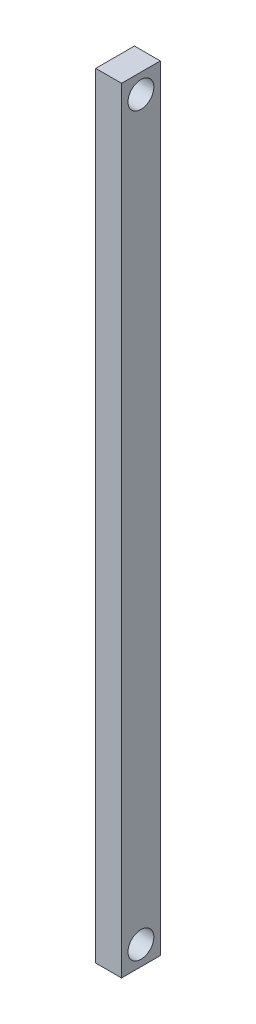
from build123d import *

# Parameters (mm, degrees)
SKETCH1_W           = 300
SKETCH1_H           = 15
BOSS_EXTRUDE1_DEPTH = 10
SKETCH3_R           = 5
CUT_EXTRUDE1_DEPTH  = 10
SKETCH4_R           = 5
CUT_EXTRUDE2_DEPTH  = 10


with BuildPart() as part:
    # Sketch1 → Boss-Extrude1 (new body)
    with BuildSketch(Plane.YZ):
        with Locations((150, 7.5)):
            Rectangle(SKETCH1_W, SKETCH1_H)
    extrude(amount=BOSS_EXTRUDE1_DEPTH)

    # Sketch3 → Cut-Extrude1 (cut)
    with BuildSketch(Plane.YZ):
        with Locations(Location((7.5, 7.5, 0), (0, 0, 270))):
            Circle(SKETCH3_R)
    extrude(amount=CUT_EXTRUDE1_DEPTH, mode=Mode.SUBTRACT)

    # Sketch4 → Cut-Extrude2 (cut)
    with BuildSketch(Plane.YZ.offset(10)):
        with Locations(Location((292.5, 7.5, 0), (0, 0, 270))):
            Circle(SKETCH4_R)
    extrude(amount=-CUT_EXTRUDE2_DEPTH, mode=Mode.SUBTRACT)


solid = part.part
